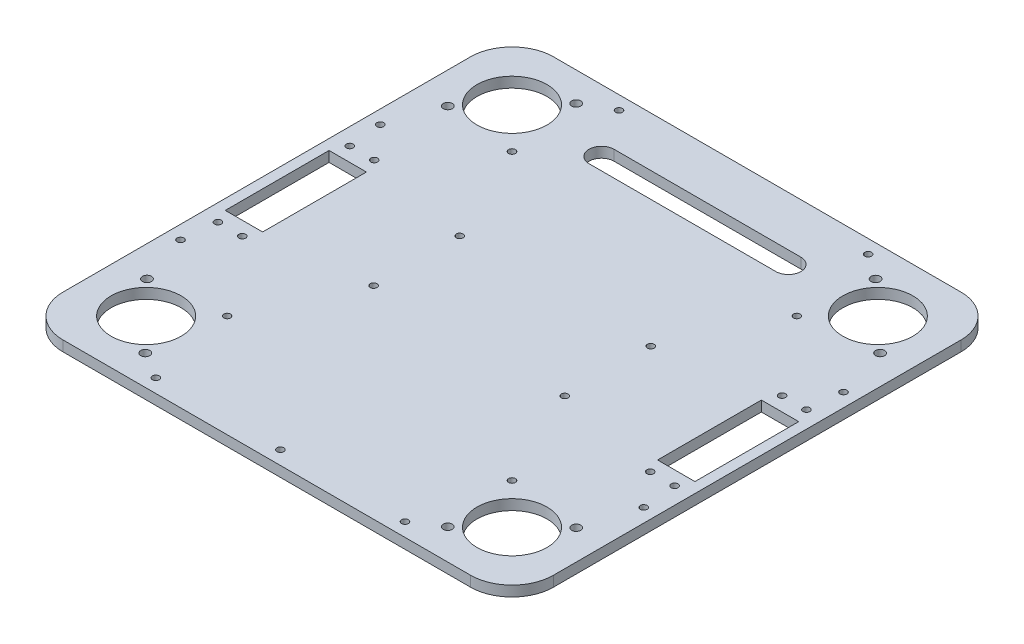
from build123d import *

# Parameters (mm, degrees)
SKETCH1_W           = 300
SKETCH1_H           = 300
BOSS_EXTRUDE1_DEPTH = 6.35
SKETCH2_R           = 2.0828
SKETCH2_R_2         = 2.778125
SKETCH2_R_3         = 21.43125
SKETCH2_W           = 22.86
SKETCH2_H           = 63.5
CUT_EXTRUDE1_DEPTH  = 213.227054119
FILLET1_R           = 25.4


with BuildPart() as part:
    # Sketch1 → Boss-Extrude1 (new body)
    with BuildSketch(Plane(origin=(0, 0, 0), x_dir=(1, 0, 0), z_dir=(0, 1, 0))):
        Rectangle(SKETCH1_W, SKETCH1_H)
    extrude(amount=BOSS_EXTRUDE1_DEPTH)

    # Sketch2 → Cut-Extrude1 (cut, through all)
    with BuildSketch(Plane(origin=(0, 6.35, 0), x_dir=(1, 0, 0), z_dir=(0, 1, 0))):
        with Locations(Location((-87.138207153, 87.138207153, 0), (0, 0, 270))):
            Circle(SKETCH2_R)
        with Locations(Location((87.138207153, 87.138207153, 0), (0, 0, 90))):
            Circle(SKETCH2_R)
        with Locations(Location((87.138207153, -87.138207153, 0), (0, 0, 270))):
            Circle(SKETCH2_R)
        with Locations(Location((-87.138207153, -87.138207153, 0), (0, 0, 90))):
            Circle(SKETCH2_R)
        with Locations(Location((-141.6688, 61.1, 0), (0, 0, 270))):
            Circle(SKETCH2_R)
        with Locations(Location((-141.6688, -61.1, 0), (0, 0, 270))):
            Circle(SKETCH2_R)
        with Locations(Location((-76.2, -141.6688, 0), (0, 0, 270))):
            Circle(SKETCH2_R)
        with Locations(Location((76.2, -141.6688, 0), (0, 0, 270))):
            Circle(SKETCH2_R)
        with Locations(Location((0, -141.6688, 0), (0, 0, 270))):
            Circle(SKETCH2_R)
        with Locations(Location((-76.2, 141.6688, 0), (0, 0, 270))):
            Circle(SKETCH2_R)
        with Locations(Location((76.2, 141.6688, 0), (0, 0, 270))):
            Circle(SKETCH2_R)
        with Locations(Location((141.6688, 61.1, 0), (0, 0, 270))):
            Circle(SKETCH2_R)
        with Locations(Location((141.6688, -61.1, 0), (0, 0, 270))):
            Circle(SKETCH2_R)
        with Locations(Location((-139.6622, 40.4492, 0), (0, 0, 270))):
            Circle(SKETCH2_R)
        with Locations(Location((-124.7778, 40.4492, 0), (0, 0, 270))):
            Circle(SKETCH2_R)
        with Locations(Location((-139.6622, -40.2212, 0), (0, 0, 270))):
            Circle(SKETCH2_R)
        with Locations(Location((-124.7778, -40.2212, 0), (0, 0, 270))):
            Circle(SKETCH2_R)
        with Locations(Location((124.7778, 40.4492, 0), (0, 0, 270))):
            Circle(SKETCH2_R)
        with Locations(Location((139.6622, 40.4492, 0), (0, 0, 270))):
            Circle(SKETCH2_R)
        with Locations(Location((124.7778, -40.2212, 0), (0, 0, 270))):
            Circle(SKETCH2_R)
        with Locations(Location((139.6622, -40.2212, 0), (0, 0, 270))):
            Circle(SKETCH2_R)
        with Locations(Location((-58.438333333, 26.439261833, 0), (0, 0, 270))):
            Circle(SKETCH2_R)
        with Locations(Location((-58.438333333, -26.211261833, 0), (0, 0, 270))):
            Circle(SKETCH2_R)
        with Locations(Location((58.438333333, 26.439261833, 0), (0, 0, 270))):
            Circle(SKETCH2_R)
        with Locations(Location((58.438333333, -26.211261833, 0), (0, 0, 270))):
            Circle(SKETCH2_R)
        with Locations(Location((-131.28002933, -91.994917364, 0), (0, 0, 270))):
            Circle(SKETCH2_R_2)
        with Locations(Location((-111.9, -111.9, 0), (0, 0, 270))):
            Circle(SKETCH2_R_3)
        with Locations(Location((-92.51997067, -131.805082636, 0), (0, 0, 90))):
            Circle(SKETCH2_R_2)
        with Locations(Location((91.994917364, -131.28002933, 0), (0, 0, 270))):
            Circle(SKETCH2_R_2)
        with Locations(Location((111.9, -111.9, 0), (0, 0, 270))):
            Circle(SKETCH2_R_3)
        with Locations(Location((131.805082636, -92.51997067, 0), (0, 0, 90))):
            Circle(SKETCH2_R_2)
        with Locations(Location((91.575239032, 130.839428269, 0), (0, 0, 270))):
            Circle(SKETCH2_R_2)
        with Locations(Location((111.9, 111.9, 0), (0, 0, 270))):
            Circle(SKETCH2_R_3)
        with Locations(Location((132.224760968, 92.960571731, 0), (0, 0, 90))):
            Circle(SKETCH2_R_2)
        with Locations(Location((-130.839428269, 91.575239032, 0), (0, 0, 270))):
            Circle(SKETCH2_R_2)
        with Locations(Location((-111.9, 111.9, 0), (0, 0, 270))):
            Circle(SKETCH2_R_3)
        with Locations(Location((-92.960571731, 132.224760968, 0), (0, 0, 90))):
            Circle(SKETCH2_R_2)
        with BuildLine():
            Line((-57.15, 119.55), (57.15, 119.55))
            ThreePointArc((57.15, 119.55), (64.8, 111.9), (57.15, 104.25))
            Line((57.15, 104.25), (-57.15, 104.25))
            ThreePointArc((-57.15, 104.25), (-64.8, 111.9), (-57.15, 119.55))
        make_face()
        with Locations((132.22, 0)):
            Rectangle(SKETCH2_W, SKETCH2_H)
        with Locations((-132.219999948, 0)):
            Rectangle(SKETCH2_W, SKETCH2_H)
    extrude(amount=-CUT_EXTRUDE1_DEPTH, mode=Mode.SUBTRACT)

    # Fillet1
    fillet1_edges = [part.edges().sort_by_distance(p)[0] for p in [
        (150, 3.175, 150),
        (-150, 3.175, 150),
        (-150, 3.175, -150),
        (150, 3.175, -150),
    ]]
    fillet(fillet1_edges, radius=FILLET1_R)


solid = part.part
